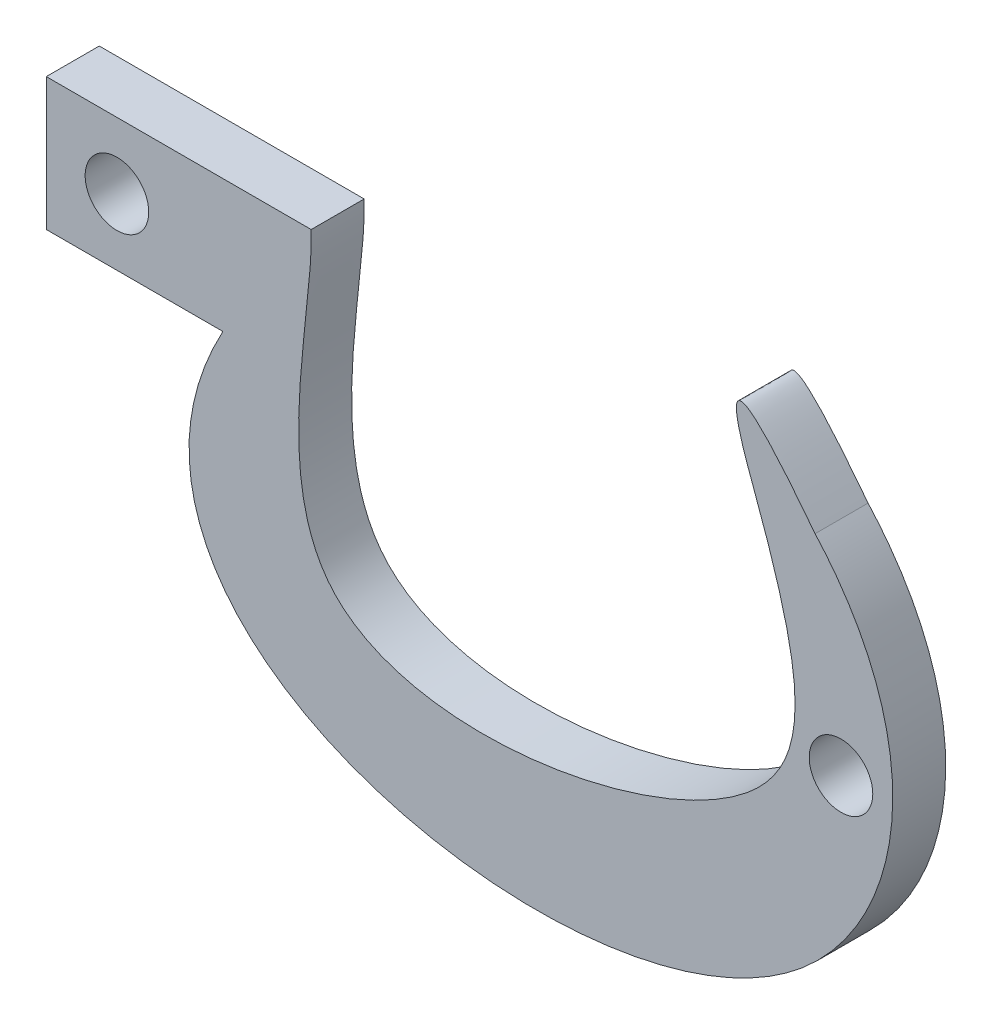
from build123d import *

# Parameters (mm, degrees)
ESQUISSE1_R        = 1.8
BOSS_EXTRU_1_DEPTH = 3


with BuildPart() as part:
    # Esquisse1 → Boss.-Extru.1 (new body)
    with BuildSketch(Plane.XY):
        with BuildLine():
            Line((-9.145330081, 11.111719912), (0.854669919, 11.111719912))
            Line((0.854669919, 11.111719912), (5.854669919, 11.111719912))
            add(Edge.make_bspline(
                [(5.854669919, 11.111719912), (6.001733277, 6.888329486), (0.382726488, -13.057760188), (35.133210567, -6.83799381), (33.778825155, 3.240433108), (30.854669919, 11.111719912)],
                knots=[0, 0, 0, 0, 0.318181818, 0.727272727, 1, 1, 1, 1], degree=3))
            add(Edge.make_bspline(
                [(34.389441517, 10.463206131), (27.90161821, 18.931491829), (30.854669919, 11.111719912)],
                knots=[0, 0, 0, 1, 1, 1], degree=2))
            add(Edge.make_bspline(
                [(0.854669919, 3.611719912), (-8.904641883, -14.392277313), (36.805178859, -24.645827474), (41.104982554, 3.016776947), (34.389441517, 10.463206131)],
                knots=[0, 0, 0, 0, 0.657630446, 1, 1, 1, 1], degree=3))
            Line((0.854669919, 3.611719912), (-9.145330081, 3.611719912))
            Line((-9.145330081, 3.611719912), (-9.145330081, 11.111719912))
        make_face()
        with Locations((-5.145330081, 7.361719912)):
            Circle(ESQUISSE1_R, mode=Mode.SUBTRACT)
        with Locations((35.854669919, -0.66900557)):
            Circle(ESQUISSE1_R, mode=Mode.SUBTRACT)
    extrude(amount=BOSS_EXTRU_1_DEPTH)


solid = part.part
